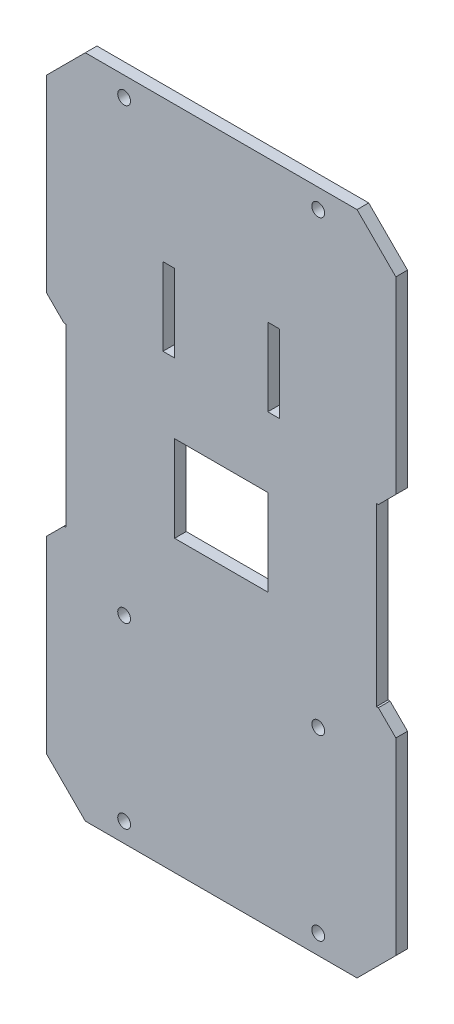
from build123d import *

# Parameters (mm, degrees)
SKETCH1_R           = 1.65
SKETCH1_W           = 3
SKETCH1_H           = 20
SKETCH1_W_2         = 24
SKETCH1_H_2         = 22.230872535
BOSS_EXTRUDE2_DEPTH = 3


with BuildPart() as part:
    # Sketch1 → Boss-Extrude2 (new body)
    with BuildSketch(Plane.XY):
        Polygon((-59.447183423, 47.780041818), (-49.447183423, 57.780041818), (20.552816577, 57.780041818), (30.552816577, 47.780041818), (30.552816577, -0.7691812), (26.052816577, -5.2691812), (25.552816577, -5.2691812), (25.552816577, -50.590735163), (26.052816577, -50.590735163), (30.552816577, -55.090735163), (30.552816577, -103.639958182), (20.552816577, -113.639958182), (-49.447183423, -113.639958182), (-59.447183423, -103.639958182), (-59.447183423, -55.090735163), (-54.947183423, -50.590735163), (-54.447183423, -50.590735163), (-54.447183423, -5.2691812), (-54.947183423, -5.2691812), (-59.447183423, -0.7691812), align=None)
        with Locations((-39.447183423, 52.780041818)):
            Circle(SKETCH1_R, mode=Mode.SUBTRACT)
        with Locations((10.552816577, 52.780041818)):
            Circle(SKETCH1_R, mode=Mode.SUBTRACT)
        with Locations(Location((10.552816577, -108.639958182, 0), (0, 0, 180))):
            Circle(SKETCH1_R, mode=Mode.SUBTRACT)
        with Locations(Location((-39.447183423, -108.639958182, 0), (0, 0, 180))):
            Circle(SKETCH1_R, mode=Mode.SUBTRACT)
        with Locations((10.552816577, -62.748057161)):
            Circle(SKETCH1_R, mode=Mode.SUBTRACT)
        with Locations(Location((-39.447183423, -62.748057161, 0), (0, 0, 180))):
            Circle(SKETCH1_R, mode=Mode.SUBTRACT)
        with Locations((-27.947183423, 11.175041818)):
            Rectangle(SKETCH1_W, SKETCH1_H, mode=Mode.SUBTRACT)
        with Locations((-0.947183423, 11.175041818)):
            Rectangle(SKETCH1_W, SKETCH1_H, mode=Mode.SUBTRACT)
        with Locations((-14.447183423, -27.929958181)):
            Rectangle(SKETCH1_W_2, SKETCH1_H_2, mode=Mode.SUBTRACT)
    extrude(amount=BOSS_EXTRUDE2_DEPTH)


solid = part.part
